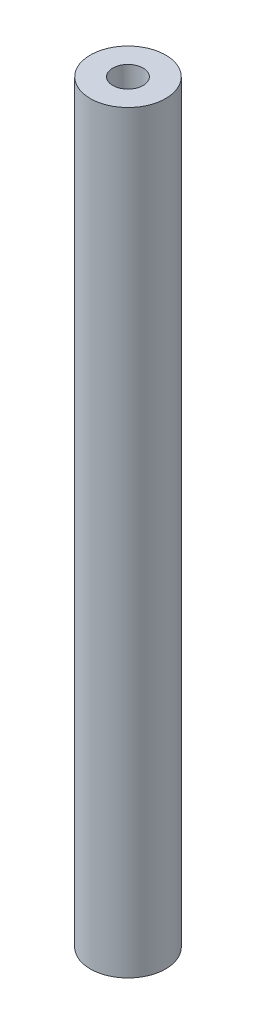
from build123d import *

# Parameters (mm, degrees)
SKETCH1_R                   = 6.35
BOSS_EXTRUDE1_DEPTH         = 127
F_1_4_20_TAPPED_HOLE3_D     = 5.1054
F_1_4_20_TAPPED_HOLE3_DEPTH = 16.51
F_1_4_20_TAPPED_HOLE3_TIP   = 1.533816902
F_1_4_20_TAPPED_HOLE4_D     = 5.1054
F_1_4_20_TAPPED_HOLE4_DEPTH = 16.51
F_1_4_20_TAPPED_HOLE4_TIP   = 1.533816902


with BuildPart() as part:
    # Sketch1 → Boss-Extrude1 (new body)
    with BuildSketch(Plane(origin=(0, 0, 0), x_dir=(1, 0, 0), z_dir=(0, 1, 0))):
        with Locations(Location((0, 0, 0), (0, 0, 270))):
            Circle(SKETCH1_R)
    extrude(amount=BOSS_EXTRUDE1_DEPTH)

    # 1/4-20 Tapped Hole3
    with Locations(Plane(origin=(0, 127, 0), x_dir=(1, 0, 0), z_dir=(0, 1, 0))):
        with Locations((0, 0)):
            Hole(F_1_4_20_TAPPED_HOLE3_D / 2, depth=F_1_4_20_TAPPED_HOLE3_DEPTH)
            with Locations((0, 0, -(F_1_4_20_TAPPED_HOLE3_DEPTH + F_1_4_20_TAPPED_HOLE3_TIP / 2))):  # 118° drill point
                Cone(0, F_1_4_20_TAPPED_HOLE3_D / 2, F_1_4_20_TAPPED_HOLE3_TIP, mode=Mode.SUBTRACT)

    # 1/4-20 Tapped Hole4
    with Locations(Plane(origin=(0, 0, 0), x_dir=(-1, 0, 0), z_dir=(0, -1, 0))):
        with Locations((0, 0)):
            Hole(F_1_4_20_TAPPED_HOLE4_D / 2, depth=F_1_4_20_TAPPED_HOLE4_DEPTH)
            with Locations((0, 0, -(F_1_4_20_TAPPED_HOLE4_DEPTH + F_1_4_20_TAPPED_HOLE4_TIP / 2))):  # 118° drill point
                Cone(0, F_1_4_20_TAPPED_HOLE4_D / 2, F_1_4_20_TAPPED_HOLE4_TIP, mode=Mode.SUBTRACT)


solid = part.part
